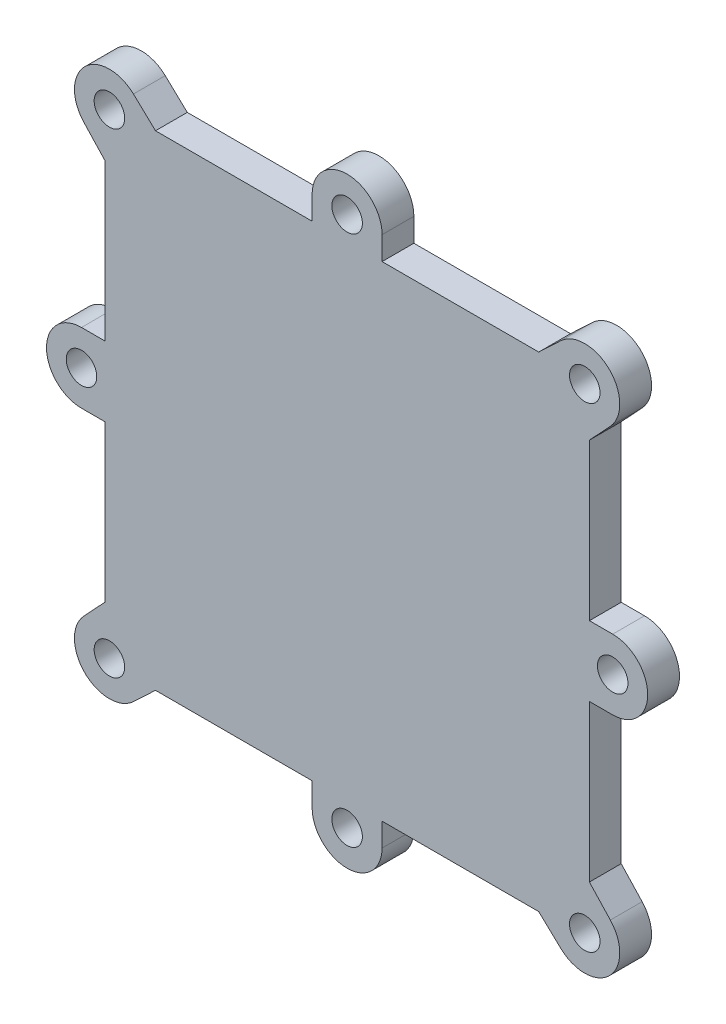
from build123d import *

# Parameters (mm, degrees)
SKETCH1_W            = 76.2
SKETCH1_H            = 76.2
BOSS_EXTRUDE1_DEPTH  = 5
FILLET1_R            = 5.334
BOSS_EXTRUDE2_DEPTH  = 5
M4_CLEARANCE_HOLE1_D = 4.8


with BuildPart() as part:
    # Sketch1 → Boss-Extrude1 (new body)
    with BuildSketch(Plane.XY):
        Rectangle(SKETCH1_W, SKETCH1_H)
    extrude(amount=BOSS_EXTRUDE1_DEPTH)

    # Fillet1
    fillet1_edges = [part.edges().sort_by_distance(p)[0] for p in [
        (38.1, -38.1, 2.5),
        (-38.1, -38.1, 2.5),
        (-38.1, 38.1, 2.5),
        (38.1, 38.1, 2.5),
    ]]
    fillet(fillet1_edges, radius=FILLET1_R)

    # Sketch2 → Boss-Extrude2 (add)
    with BuildSketch(Plane.XY.offset(5)):
        with BuildLine():
            Line((-38.1, -30.090129163), (-41.393974839, -33.620461233))
            ThreePointArc((-41.393974839, -33.620461233), (-41.250124596, -41.273219147), (-33.596647392, -41.371622715))
            Line((-33.596647392, -41.371622715), (-30.131751686, -38.1))
            Line((-30.131751686, -38.1), (-5.5, -38.1))
            Line((-5.5, -38.1), (-5.5, -41.7647))
            ThreePointArc((-5.5, -41.7647), (0, -47.2647), (5.5, -41.7647))
            Line((5.5, -41.7647), (5.5, -38.1))
            Line((5.5, -38.1), (30.131751686, -38.1))
            Line((30.131751686, -38.1), (33.596647392, -41.371622715))
            ThreePointArc((33.596647392, -41.371622715), (41.250124596, -41.273219147), (41.393974839, -33.620461233))
            Line((41.393974839, -33.620461233), (38.1, -30.090129163))
            Line((38.1, -30.090129163), (38.1, -5.5))
            Line((38.1, -5.5), (41.7647, -5.5))
            ThreePointArc((41.7647, -5.5), (47.2647, 0), (41.7647, 5.5))
            Line((41.7647, 5.5), (38.1, 5.5))
            Line((38.1, 5.5), (38.1, 30.090129163))
            Line((38.1, 30.090129163), (41.393974839, 33.620461233))
            ThreePointArc((41.393974839, 33.620461233), (41.250124596, 41.273219147), (33.596647392, 41.371622715))
            Line((33.596647392, 41.371622715), (30.131751686, 38.1))
            Line((30.131751686, 38.1), (5.5, 38.1))
            Line((5.5, 38.1), (5.5, 41.7647))
            ThreePointArc((5.5, 41.7647), (0, 47.2647), (-5.5, 41.7647))
            Line((-5.5, 41.7647), (-5.5, 38.1))
            Line((-5.5, 38.1), (-30.131751686, 38.1))
            Line((-30.131751686, 38.1), (-33.596647392, 41.371622715))
            ThreePointArc((-33.596647392, 41.371622715), (-41.250124596, 41.273219147), (-41.393974839, 33.620461233))
            Line((-41.393974839, 33.620461233), (-38.1, 30.090129163))
            Line((-38.1, 30.090129163), (-38.1, 5.5))
            Line((-38.1, 5.5), (-41.7647, 5.5))
            ThreePointArc((-41.7647, 5.5), (-47.2647, 0), (-41.7647, -5.5))
            Line((-41.7647, -5.5), (-38.1, -5.5))
            Line((-38.1, -5.5), (-38.1, -30.090129163))
        make_face()
    extrude(amount=-BOSS_EXTRUDE2_DEPTH)

    # M4 Clearance Hole1 (through all)
    with Locations(Plane.XY.offset(5)):
        with Locations((0, -41.7647), (37.372601718, -37.372601718), (-37.372601718, -37.372601718), (-41.7647, 0), (41.7647, 0), (37.372601718, 37.372601718), (0, 41.7647), (-37.372601718, 37.372601718)):
            Hole(M4_CLEARANCE_HOLE1_D / 2)


solid = part.part
